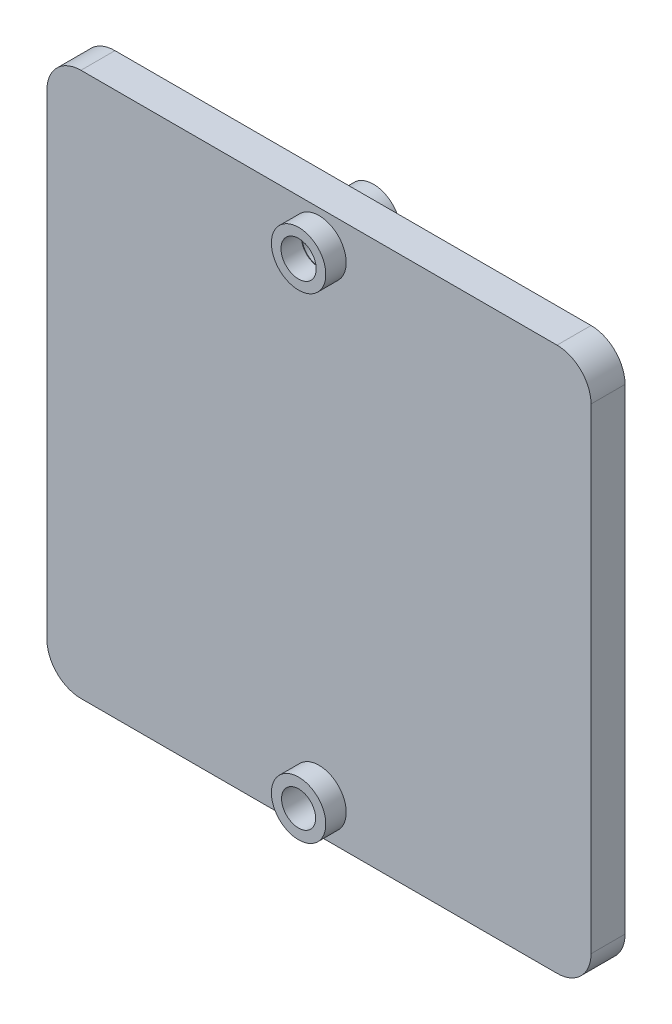
from build123d import *

# Parameters (mm, degrees)
SKETCH1_W                = 400
SKETCH1_H                = 400
BOSS_EXTRUDE1_DEPTH      = 25
FILLET1_R                = 25
SKETCH2_R                = 12.5
CUT_EXTRUDE1_DEPTH       = 25
BOSS_EXTRUDE2_DEPTH      = 15
BOSS_EXTRUDE2_DEPTH_BACK = 40
SKETCH3_R                = 20
SKETCH3_R_2              = 12.957739805
SKETCH3_R_3              = 12.5


with BuildPart() as part:
    # Sketch1 → Boss-Extrude1 (new body)
    with BuildSketch(Plane.XY):
        with Locations((200, -200)):
            Rectangle(SKETCH1_W, SKETCH1_H)
    extrude(amount=BOSS_EXTRUDE1_DEPTH)

    # Fillet1
    fillet1_edges = [part.edges().sort_by_distance(p)[0] for p in [
        (0, 0, 12.5),
        (400, 0, 12.5),
        (400, -400, 12.5),
        (0, -400, 12.5),
    ]]
    fillet(fillet1_edges, radius=FILLET1_R)

    # Sketch2 → Cut-Extrude1 (cut)
    with BuildSketch(Plane(origin=(0, 0, 0), x_dir=(-1, 0, 0), z_dir=(0, 0, -1))):
        with Locations((-200, -25)):
            Circle(SKETCH2_R)
        with Locations((-200, -375)):
            Circle(SKETCH2_R)
    extrude(amount=-CUT_EXTRUDE1_DEPTH, mode=Mode.SUBTRACT)

    # Sketch3 → Boss-Extrude2 (add, two sides: drawn at the far end of the back side and taken through both)
    # profile 1 of 2: a face of its own
    with BuildSketch(Plane(origin=(0, 0, 0), x_dir=(-1, 0, 0), z_dir=(0, 0, -1)).offset(-BOSS_EXTRUDE2_DEPTH_BACK)):
        with Locations((-200, -25)):
            Circle(SKETCH3_R)
        with Locations((-200, -25)):
            Circle(SKETCH3_R_2, mode=Mode.SUBTRACT)
    # profile 2 of 2: a face of its own
    with BuildSketch(Plane(origin=(0, 0, 0), x_dir=(-1, 0, 0), z_dir=(0, 0, -1)).offset(-BOSS_EXTRUDE2_DEPTH_BACK)):
        with Locations((-200, -375)):
            Circle(SKETCH3_R)
        with Locations((-200, -375)):
            Circle(SKETCH3_R_3, mode=Mode.SUBTRACT)
    extrude(amount=BOSS_EXTRUDE2_DEPTH + BOSS_EXTRUDE2_DEPTH_BACK)


solid = part.part
